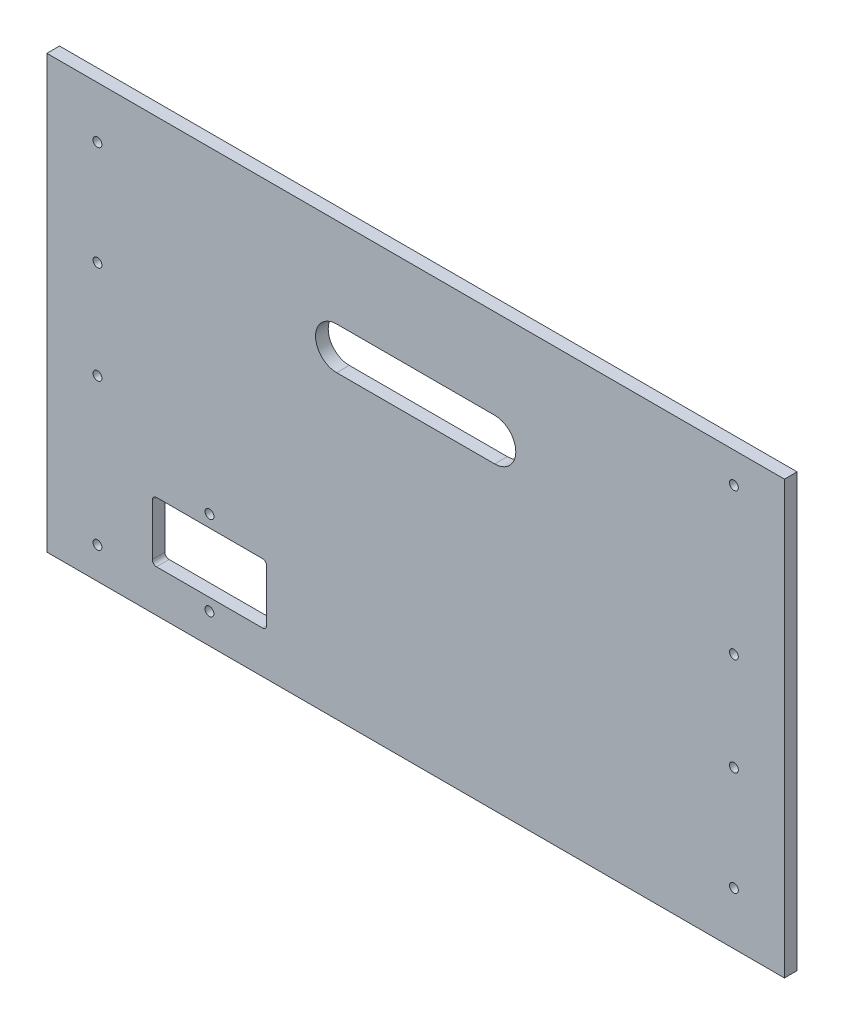
from build123d import *

# Parameters (mm, degrees)
ESBO_O1_W                    = 350
ESBO_O1_H                    = 205
RESSALTO_EXTRUS_O1_DEPTH     = 6
CORTE_EXTRUS_O1_DEPTH        = 203.897141429
ESBO_O3_R                    = 2.1
CORTE_EXTRUS_O2_DEPTH        = 203.897141429
FURO_DE_DI_METRO_4_2_4_2_1_D = 4.2


with BuildPart() as part:
    # Esboço1 → Ressalto-extrusão1 (new body)
    with BuildSketch(Plane.XY):
        Rectangle(ESBO_O1_W, ESBO_O1_H)
    extrude(amount=RESSALTO_EXTRUS_O1_DEPTH)

    # Esboço2 → Corte-extrusão1 (cut, through all)
    with BuildSketch(Plane.XY.offset(6)):
        with BuildLine():
            Line((-37.5, 60), (37.5, 60))
            ThreePointArc((37.5, 60), (47.5, 50), (37.5, 40))
            Line((37.5, 40), (-37.5, 40))
            ThreePointArc((-37.5, 40), (-47.5, 50), (-37.5, 60))
        make_face()
    extrude(amount=-CORTE_EXTRUS_O1_DEPTH, mode=Mode.SUBTRACT)

    # Esboço3 → Corte-extrusão2 (cut, through all)
    with BuildSketch(Plane.XY.offset(6)):
        with Locations((-97.85, -48.25)):
            Circle(ESBO_O3_R)
        with Locations((-97.85, -88.25)):
            Circle(ESBO_O3_R)
        with BuildLine():
            Line((-123, -82.5), (-72.7, -82.5))
            ThreePointArc((-72.7, -82.5), (-71.285786438, -81.914213562), (-70.7, -80.5))
            Line((-70.7, -80.5), (-70.7, -56))
            ThreePointArc((-70.7, -56), (-71.285786438, -54.585786438), (-72.7, -54))
            Line((-72.7, -54), (-123, -54))
            ThreePointArc((-123, -54), (-124.414213562, -54.585786438), (-125, -56))
            Line((-125, -56), (-125, -80.5))
            ThreePointArc((-125, -80.5), (-124.414213562, -81.914213562), (-123, -82.5))
        make_face()
    extrude(amount=-CORTE_EXTRUS_O2_DEPTH, mode=Mode.SUBTRACT)

    # Furo de diâmetro Ø4.2 (4.2)1 (through all)
    with Locations(Plane.XY.offset(6)):
        with Locations((-151, -87.5), (-151, -18), (151, -28), (151, -77.5), (151, 88), (151, 18.5), (-151, 78), (-151, 28.5)):
            Hole(FURO_DE_DI_METRO_4_2_4_2_1_D / 2)


solid = part.part
